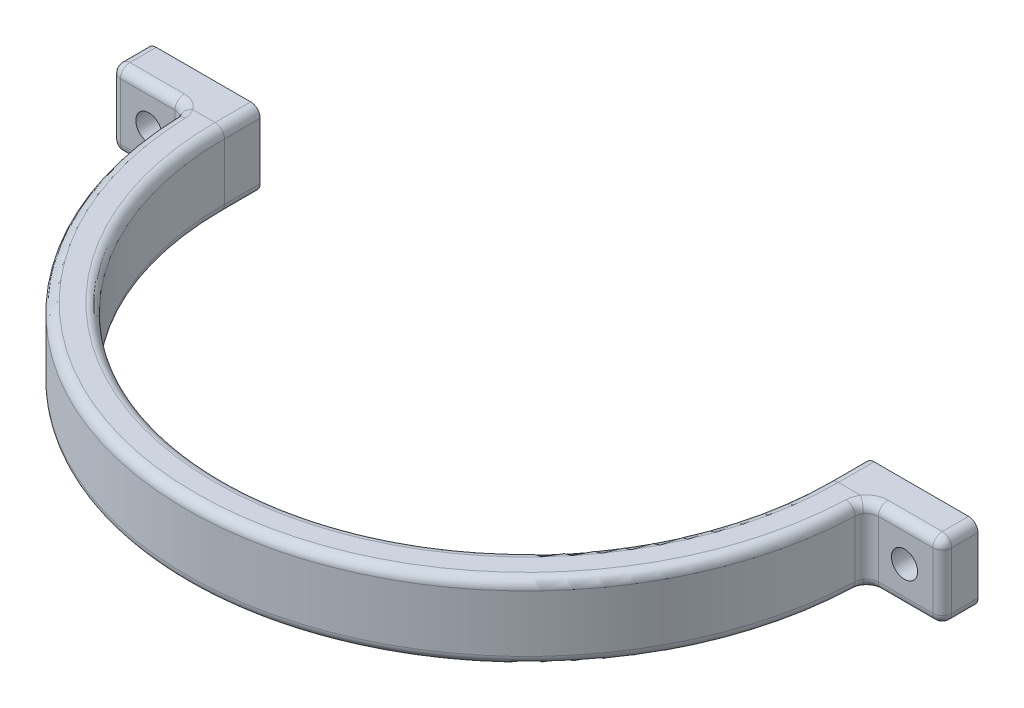
from build123d import *

# Parameters (mm, degrees)
SKETCH2_W           = 6.35
SKETCH2_H           = 6.35
SKETCH2_R           = 1.1
BOSS_EXTRUDE1_DEPTH = 3
SKETCH4_W           = 3.175
SKETCH4_H           = 6.35
FILLET1_R           = 1
FILLET3_R           = 0.79375


with BuildPart() as part:
    # Sketch2 → Boss-Extrude1 (new body)
    with BuildSketch(Plane.XY):
        with Locations((-31.75, 0)):
            Rectangle(SKETCH2_W, SKETCH2_H)
        with Locations((-31.75, 0)):
            Circle(SKETCH2_R, mode=Mode.SUBTRACT)
    extrude(amount=BOSS_EXTRUDE1_DEPTH)

    # Sweep1: sweep along a path in Sketch3
    with BuildLine(Plane(origin=(0, 0, 0), x_dir=(1, 0, 0), z_dir=(0, 1, 0))) as sweep1_path:
        Line((-28.575, 0), (-28.575, -3))
        ThreePointArc((-28.575, -3), (-20.205576272, -23.205576272), (0, -31.575))
    # Sketch4 → Sweep1 (sweep)
    with BuildSketch(Plane.XY):
        with Locations((-26.9875, 0)):
            Rectangle(SKETCH4_W, SKETCH4_H)
    sweep(path=sweep1_path.line)

    # Fillet1
    fillet1_edges = [part.edges().sort_by_distance(p)[0] for p in [
        (-28.575, 0, 3),
    ]]
    fillet(fillet1_edges, radius=FILLET1_R)

    # Fillet3
    fillet3_edges = [part.edges().sort_by_distance(p)[0] for p in [
        (-25.4, 3.175, 1.5),
        (-25.4, -3.175, 1.5),
        (-17.960512242, 3.175, 20.960512242),
        (-17.960512242, -3.175, 20.960512242),
        (-19.861039911, -3.175, 23.54433544),
        (-28.863039479, -3.175, 3.28103813),
        (-19.861039911, 3.175, 23.54433544),
        (-28.863039479, 3.175, 3.28103813),
        (-32.241544497, -3.175, 3),
        (-34.925, 0, 3),
        (-34.925, 3.175, 1.5),
        (-34.925, -3.175, 1.5),
        (-32.241544497, 3.175, 3),
    ]]
    fillet(fillet3_edges, radius=FILLET3_R)

    # Mirror1: part across plane


with BuildPart() as part_1:
    add(part.part)
    add(part.part.mirror(Plane(origin=(0, 0, 3), x_dir=(0, 0, 1), z_dir=(1, 0, 0))))


solid = part_1.part
